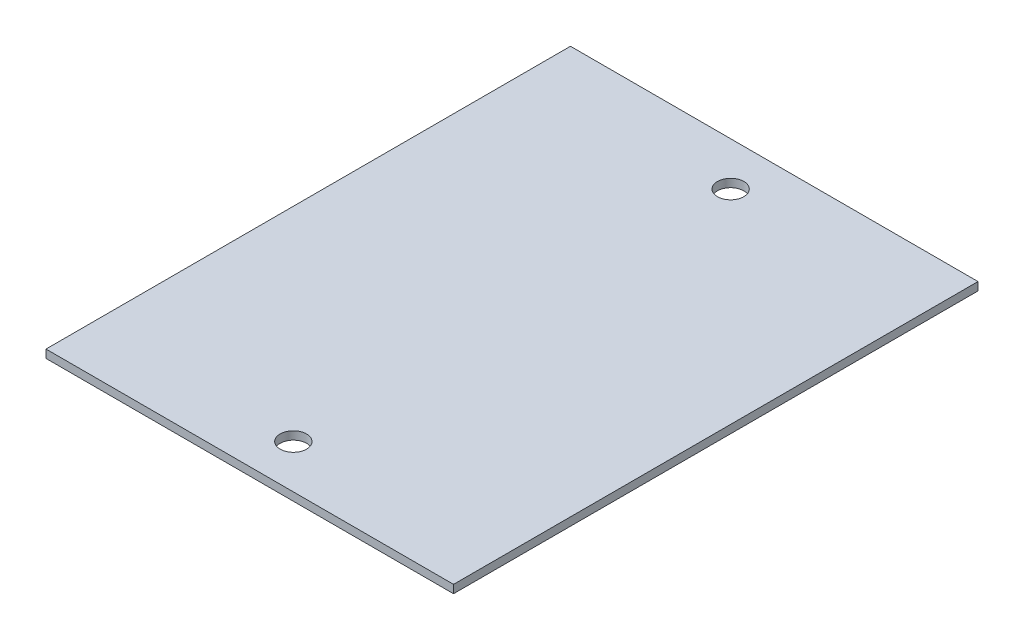
from build123d import *

# Parameters (mm, degrees)
SKETCH1_W           = 63.5
SKETCH1_H           = 81.718485214
SKETCH1_R           = 2.0574
BOSS_EXTRUDE1_DEPTH = 1.27


with BuildPart() as part:
    # Sketch1 → Boss-Extrude1 (new body)
    with BuildSketch(Plane(origin=(0, 0, 0), x_dir=(1, 0, 0), z_dir=(0, 1, 0))):
        Rectangle(SKETCH1_W, SKETCH1_H)
        with Locations(Location((0, 34.06775, 0), (0, 0, 270))):
            Circle(SKETCH1_R, mode=Mode.SUBTRACT)
        with Locations(Location((0, -34.06775, 0), (0, 0, 270))):
            Circle(SKETCH1_R, mode=Mode.SUBTRACT)
    extrude(amount=BOSS_EXTRUDE1_DEPTH)


solid = part.part
